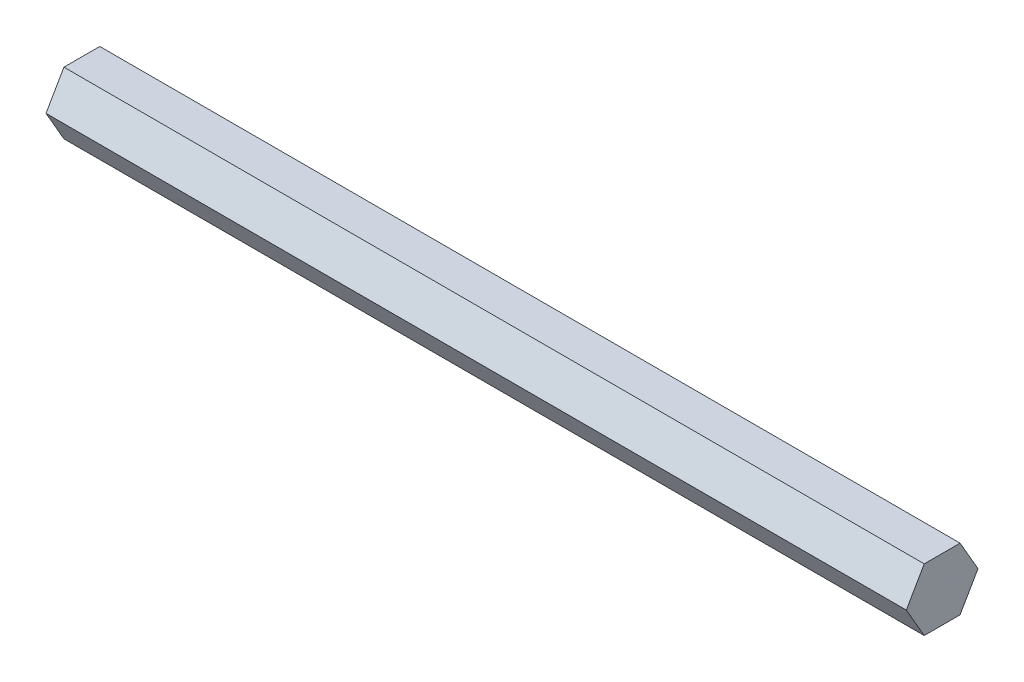
from build123d import *

# Parameters (mm, degrees)
BOSS_EXTRUDE1_DEPTH = 114.3


with BuildPart() as part:
    # Sketch1 → Boss-Extrude1 (new body)
    with BuildSketch(Plane(origin=(0, 0, 0), x_dir=(0, 0, -1), z_dir=(1, 0, 0))):
        Polygon((4.7625, 0), (2.38125, 4.124445986), (-2.38125, 4.124445986), (-4.7625, 0), (-2.38125, -4.124445986), (2.38125, -4.124445986), align=None)
    extrude(amount=BOSS_EXTRUDE1_DEPTH)


solid = part.part
